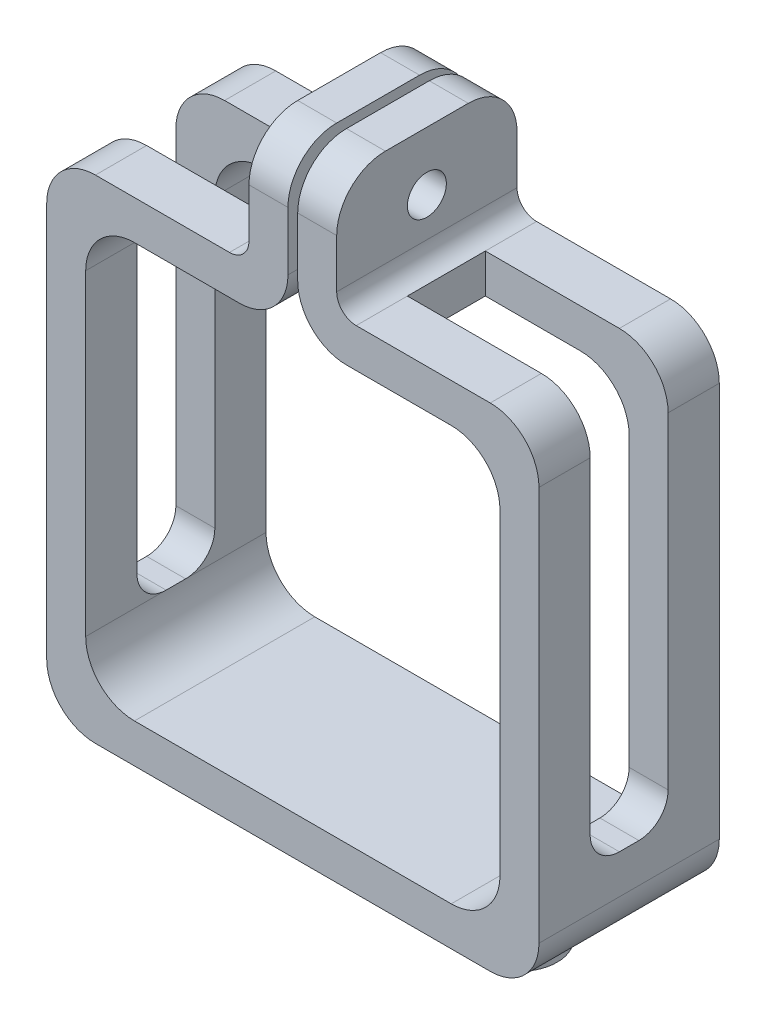
from build123d import *
from OCP.BRepFilletAPI import BRepFilletAPI_MakeFillet

# Parameters (mm, degrees)
SKETCH1_W                    = 50.5
SKETCH1_H                    = 50.5
SKETCH1_W_2                  = 42.5
SKETCH1_H_2                  = 42.5
BOSS_EXTRUDE1_DEPTH          = 9.25
SKETCH2_W                    = 1
SKETCH2_H                    = 4
CUT_EXTRUDE1_DEPTH           = 41.21660105
SKETCH3_W                    = 4
SKETCH3_H                    = 12
BOSS_EXTRUDE2_DEPTH          = 18.5
SKETCH4_R                    = 2
CUT_EXTRUDE2_DEPTH           = 49.561172762
FILLET1_R1                   = 5
FILLET1_R2                   = 2
SKETCH5_W                    = 18.75
SKETCH5_H                    = 8
CUT_EXTRUDE3_DEPTH           = 41.5
FILLET2_R                    = 3
SKETCH6_R                    = 4
BOSS_EXTRUDE3_DEPTH          = 5
SKETCH7_R                    = 1.675
CUT_EXTRUDE4_DEPTH           = 5
CUT_EXTRUDE4_DRAFT           = -2
CUT_EXTRUDE4_PROFILE_2_DEPTH = 5
CUT_EXTRUDE4_PROFILE_2_DRAFT = -2
FILLET3_R                    = 2


with BuildPart() as part:
    # Sketch1 → Boss-Extrude1 (new, symmetric)
    with BuildSketch(Plane.XY):
        Rectangle(SKETCH1_W, SKETCH1_H)
        Rectangle(SKETCH1_W_2, SKETCH1_H_2, mode=Mode.SUBTRACT)
    extrude(amount=BOSS_EXTRUDE1_DEPTH, both=True)

    # Sketch2 → Cut-Extrude1 (cut, through all)
    with BuildSketch(Plane.XY.offset(9.25)):
        with Locations((0, 23.25)):
            Rectangle(SKETCH2_W, SKETCH2_H)
    extrude(amount=-CUT_EXTRUDE1_DEPTH, mode=Mode.SUBTRACT)

    # Sketch3 → Boss-Extrude2 (add)
    with BuildSketch(Plane.XY.offset(9.25)):
        with Locations((2.5, 31.25)):
            Rectangle(SKETCH3_W, SKETCH3_H)
        with Locations((-2.5, 31.25)):
            Rectangle(SKETCH3_W, SKETCH3_H)
    extrude(amount=-BOSS_EXTRUDE2_DEPTH)

    # Sketch4 → Cut-Extrude2 (cut, through all)
    with BuildSketch(Plane(origin=(4.5, 0, 0), x_dir=(0, 0, -1), z_dir=(1, 0, 0))):
        with Locations((0, 31.25)):
            Circle(SKETCH4_R)
    extrude(amount=-CUT_EXTRUDE2_DEPTH, mode=Mode.SUBTRACT)

    # Fillet1: one fillet with a radius per group of edges: ONE call of the kernel's fillet builder (fillet() takes one radius for all edges)
    fillet1_edges_1 = [part.edges().sort_by_distance(p)[0] for p in [
        (-21.25, 21.25, 0),
        (-21.25, -21.25, 0),
        (21.25, -21.25, 0),
        (21.25, 21.25, 0),
        (-0.5, 21.25, 0),
        (0.5, 21.25, 0),
        (2.5, 37.25, 9.25),
        (2.5, 37.25, -9.25),
        (-2.5, 37.25, 9.25),
        (-2.5, 37.25, -9.25),
        (25.25, -25.25, 0),
        (-25.25, -25.25, 0),
        (-25.25, 25.25, 0),
        (25.25, 25.25, 0),
    ]]
    fillet1_edges_2 = [part.edges().sort_by_distance(p)[0] for p in [
        (4.5, 25.25, 0),
        (-4.5, 25.25, 0),
    ]]
    fillet1 = BRepFilletAPI_MakeFillet(part.part.solid().wrapped)
    for e in fillet1_edges_1:
        fillet1.Add(FILLET1_R1, e.wrapped)
    for e in fillet1_edges_2:
        fillet1.Add(FILLET1_R2, e.wrapped)
    add(Compound.cast(fillet1.Shape()), mode=Mode.REPLACE)

    # Sketch5 → Cut-Extrude3 (cut)
    with BuildSketch(Plane(origin=(0, 25.25, 0), x_dir=(1, 0, 0), z_dir=(0, 1, 0))):
        with Locations((-15.875, 0)):
            Rectangle(SKETCH5_W, SKETCH5_H)
        with Locations((15.875, 0)):
            Rectangle(SKETCH5_W, SKETCH5_H)
    extrude(amount=-CUT_EXTRUDE3_DEPTH, mode=Mode.SUBTRACT)

    # Fillet2
    fillet2_edges = [part.edges().sort_by_distance(p)[0] for p in [
        (-23.25, -16.25, 4),
        (-23.25, -16.25, -4),
        (23.25, -16.25, -4),
        (23.25, -16.25, 4),
    ]]
    fillet(fillet2_edges, radius=FILLET2_R)

    # Sketch6 → Boss-Extrude3 (add)
    with BuildSketch(Plane(origin=(0, -25.25, 0), x_dir=(-1, 0, 0), z_dir=(0, -1, 0))):
        with Locations((-13.875, 0)):
            Circle(SKETCH6_R)
        with Locations((13.875, 0)):
            Circle(SKETCH6_R)
    extrude(amount=BOSS_EXTRUDE3_DEPTH)


with BuildPart() as cut_extrude4_tool:
    # Sketch7 → Cut-Extrude4 (with draft: the straight prism first)
    with BuildSketch(Plane(origin=(0, -30.25, 0), x_dir=(-1, 0, 0), z_dir=(0, -1, 0))):
        with Locations((-13.875, 0)):
            Circle(SKETCH7_R)
    extrude(amount=-CUT_EXTRUDE4_DEPTH)
    # Cut-Extrude4: the draft: its side faces are tilted about the plane it starts from
    cut_extrude4_sides = [cut_extrude4_tool.faces().sort_by_distance(p)[0] for p in [
        (15.55, -27.75, 0),
    ]]
    draft(cut_extrude4_sides, Plane(origin=(0, -30.25, 0), x_dir=(-1, 0, 0), z_dir=(0, -1, 0)), CUT_EXTRUDE4_DRAFT)


with BuildPart() as part_1:
    add(part.part)

    # Cut-Extrude4: cut by cut_extrude4_tool
    add(cut_extrude4_tool.part, mode=Mode.SUBTRACT)


with BuildPart() as cut_extrude4_profile_2_tool:
    # Sketch7 → Cut-Extrude4 profile 2 (with draft: the straight prism first)
    with BuildSketch(Plane(origin=(0, -30.25, 0), x_dir=(-1, 0, 0), z_dir=(0, -1, 0))):
        with Locations((13.875, 0)):
            Circle(SKETCH7_R)
    extrude(amount=-CUT_EXTRUDE4_PROFILE_2_DEPTH)
    # Cut-Extrude4 profile 2: the draft: its side faces are tilted about the plane it starts from
    cut_extrude4_profile_2_sides = [cut_extrude4_profile_2_tool.faces().sort_by_distance(p)[0] for p in [
        (-12.2, -27.75, 0),
    ]]
    draft(cut_extrude4_profile_2_sides, Plane(origin=(0, -30.25, 0), x_dir=(-1, 0, 0), z_dir=(0, -1, 0)), CUT_EXTRUDE4_PROFILE_2_DRAFT)


with BuildPart() as part_2:
    add(part_1.part)

    # Cut-Extrude4 profile 2: cut by cut_extrude4_profile_2_tool
    add(cut_extrude4_profile_2_tool.part, mode=Mode.SUBTRACT)

    # Fillet3
    fillet3_edges = [part_2.edges().sort_by_distance(p)[0] for p in [
        (17.875, -25.25, 0),
        (-9.875, -25.25, 0),
    ]]
    fillet(fillet3_edges, radius=FILLET3_R)


solid = part_2.part
